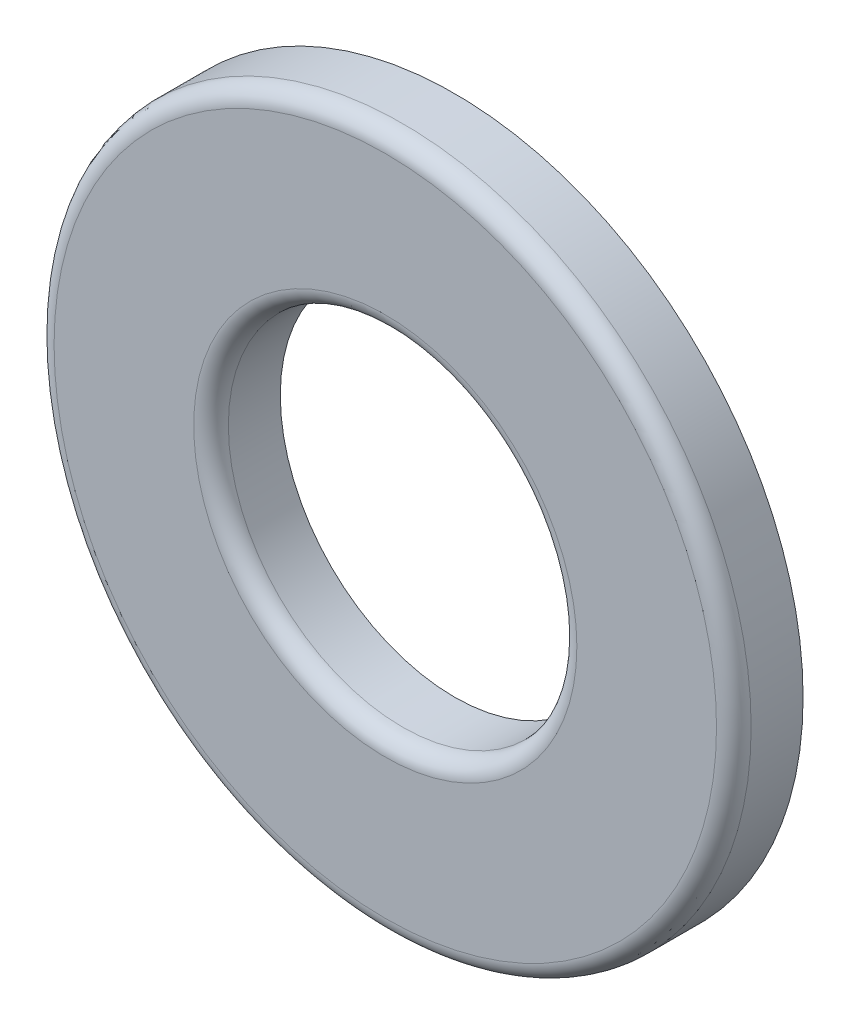
from build123d import *

# Parameters (mm, degrees)
BOSS_EXTRUDE1_DEPTH      = 0.3937
BOSS_EXTRUDE1_DEPTH_BACK = 0.3937
SKETCH3_R                = 3.9624
SKETCH3_R_2              = 1.9812
FILLET1_R                = 0.19685


with BuildPart() as part:
    # Sketch3 → Boss-Extrude1 (new, two sides: drawn at the far end of the back side and taken through both)
    with BuildSketch(Plane.XY.offset(-BOSS_EXTRUDE1_DEPTH_BACK)):
        Circle(SKETCH3_R)
        Circle(SKETCH3_R_2, mode=Mode.SUBTRACT)
    extrude(amount=BOSS_EXTRUDE1_DEPTH + BOSS_EXTRUDE1_DEPTH_BACK)

    # Fillet1
    fillet1_edges = [part.edges().sort_by_distance(p)[0] for p in [
        (-3.9624, 0, 0.3937),
        (-1.9812, 0, 0.3937),
    ]]
    fillet(fillet1_edges, radius=FILLET1_R)


solid = part.part
